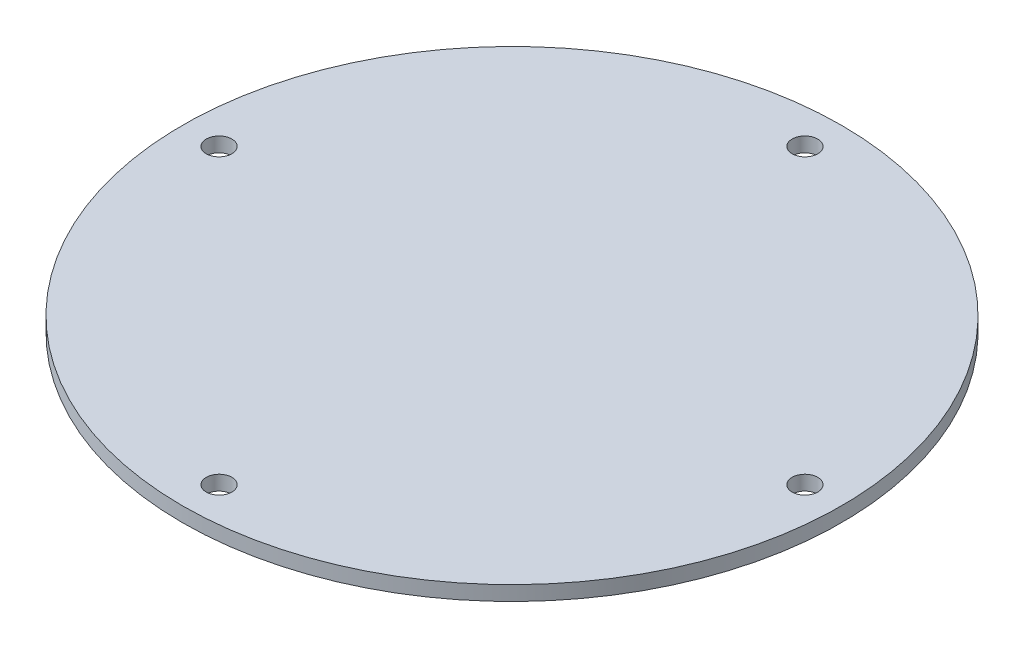
from build123d import *

# Parameters (mm, degrees)
SKETCH2_R           = 45
BOSS_EXTRUDE1_DEPTH = 2
SKETCH4_R           = 1.75
CUT_EXTRUDE1_DEPTH  = 64.671029519


with BuildPart() as part:
    # Sketch2 → Boss-Extrude1 (new body)
    with BuildSketch(Plane(origin=(0, 0, 0), x_dir=(1, 0, 0), z_dir=(0, 1, 0))):
        with Locations(Location((0, 0, 0), (0, 0, 270))):
            Circle(SKETCH2_R)
    extrude(amount=BOSS_EXTRUDE1_DEPTH)

    # Sketch4 → Cut-Extrude1 (cut, through all)
    with BuildSketch(Plane(origin=(0, 2, 0), x_dir=(1, 0, 0), z_dir=(0, 1, 0))):
        with Locations(Location((0, 40, 0), (0, 0, 270))):
            Circle(SKETCH4_R)
        with Locations(Location((40, 0, 0), (0, 0, 270))):
            Circle(SKETCH4_R)
        with Locations(Location((0, -40, 0), (0, 0, 270))):
            Circle(SKETCH4_R)
        with Locations(Location((-40, 0, 0), (0, 0, 270))):
            Circle(SKETCH4_R)
    extrude(amount=-CUT_EXTRUDE1_DEPTH, mode=Mode.SUBTRACT)


solid = part.part
